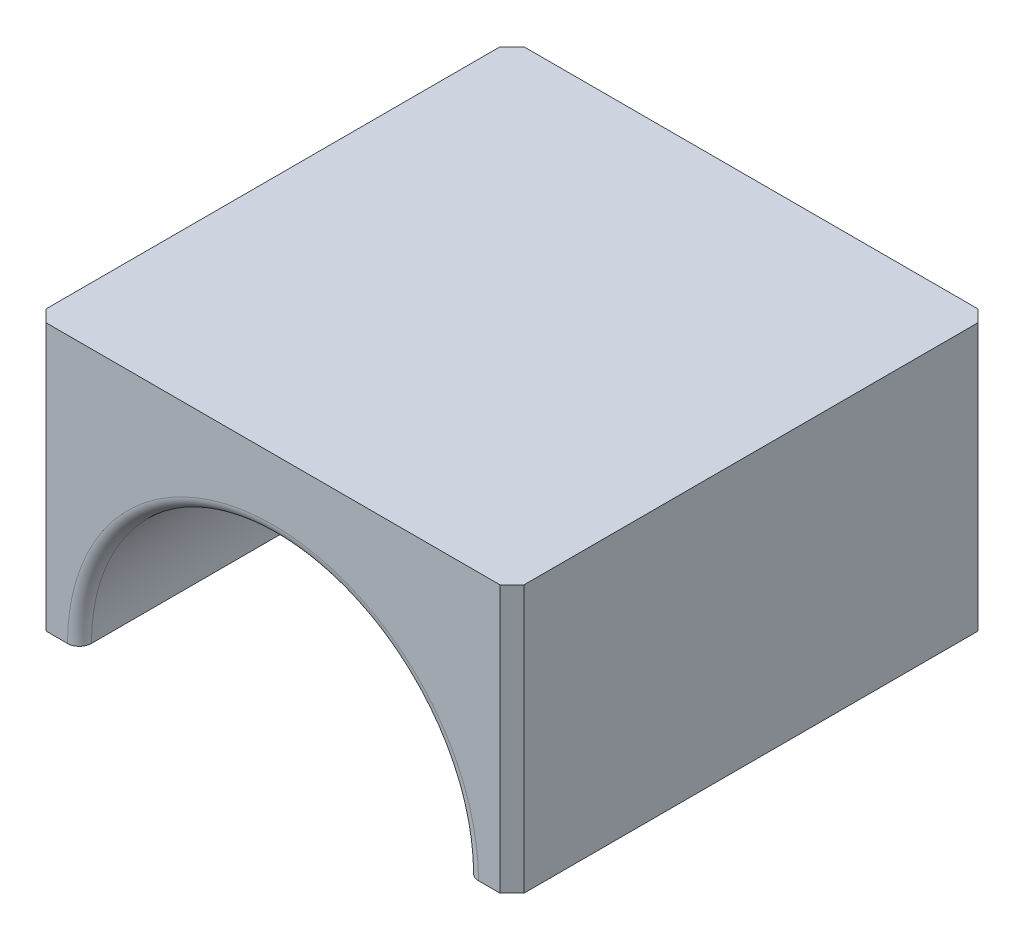
from build123d import *

# Parameters (mm, degrees)
EXTRUDE_1_DEPTH = 20
FILLET_1_R      = 0.5
CHAMFER_1_SIZE  = 0.5


with BuildPart() as part:
    # 草图1 → 凸台-拉伸1 (new body)
    with BuildSketch(Plane.XY):
        with BuildLine():
            Line((-10, -1.5875), (-10, -9.5875))
            Line((-10, -9.5875), (-8.1, -9.5875))
            ThreePointArc((-8.1, -9.5875), (0, -1.4875), (8.1, -9.5875))
            Line((8.1, -9.5875), (10, -9.5875))
            Line((10, -9.5875), (10, -1.5875))
            Line((10, -1.5875), (10, 1.5875))
            Line((10, 1.5875), (-10, 1.5875))
            Line((-10, 1.5875), (-10, -1.5875))
        make_face()
    extrude(amount=EXTRUDE_1_DEPTH)

    # 圆角1
    fillet_1_edges = [part.edges().sort_by_distance(p)[0] for p in [
        (0, -1.4875, 20),
        (0, -1.4875, 0),
    ]]
    fillet(fillet_1_edges, radius=FILLET_1_R)

    # 倒角1
    chamfer_1_edges = [part.edges().sort_by_distance(p)[0] for p in [
        (10, -4, 0),
        (-10, -4, 20),
        (10, -4, 20),
        (-10, -4, 0),
    ]]
    chamfer(chamfer_1_edges, length=CHAMFER_1_SIZE)


solid = part.part
